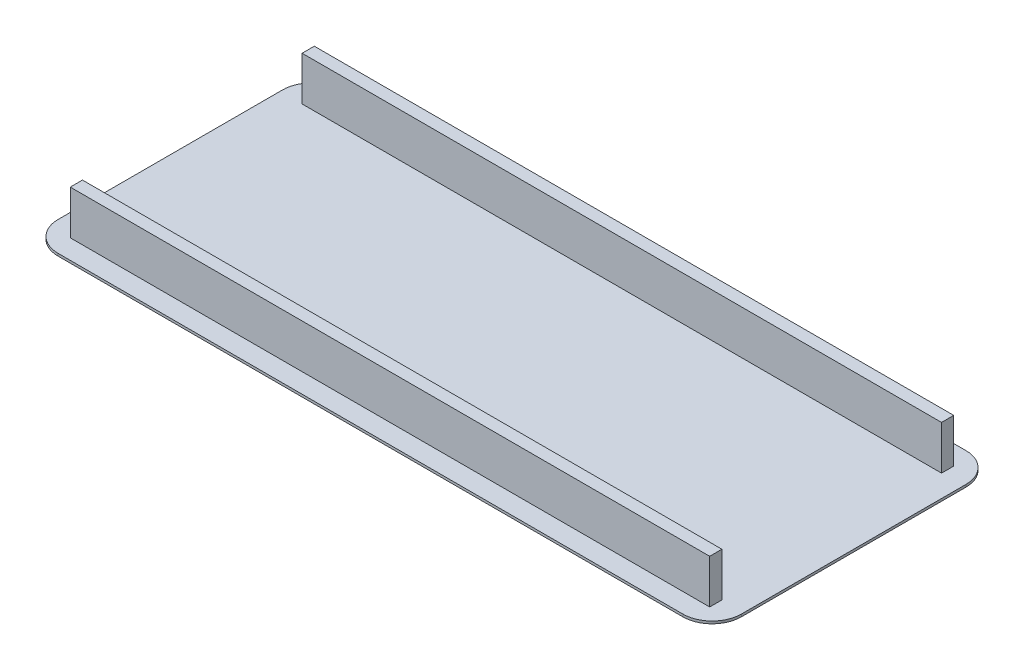
from build123d import *

# Parameters (mm, degrees)
EXTRUDE_1_DEPTH     = 0.5
SKETCH_2_W          = 131
SKETCH_2_H          = 2.5
EXTRUDE_2_DEPTH     = 9
CUT_EXTRUDE_2_DEPTH = 0.3


with BuildPart() as part:
    # 草图1 → 凸台-拉伸1 (new body)
    with BuildSketch(Plane(origin=(0, 0, 0), x_dir=(1, 0, 0), z_dir=(0, 1, 0))):
        with BuildLine():
            Line((-64, 29), (64, 29))
            ThreePointArc((64, 29), (68.242640687, 27.242640687), (70, 23))
            Line((70, 23), (70, -23))
            ThreePointArc((70, -23), (68.242640687, -27.242640687), (64, -29))
            Line((64, -29), (-64, -29))
            ThreePointArc((-64, -29), (-68.242640687, -27.242640687), (-70, -23))
            Line((-70, -23), (-70, 23))
            ThreePointArc((-70, 23), (-68.242640687, 27.242640687), (-64, 29))
        make_face()
    extrude(amount=EXTRUDE_1_DEPTH)

    # 草图2 → 凸台-拉伸2 (add)
    with BuildSketch(Plane(origin=(0, 0.5, 0), x_dir=(1, 0, 0), z_dir=(0, 1, 0))):
        with Locations((0, -23.75)):
            Rectangle(SKETCH_2_W, SKETCH_2_H)
        with Locations((0, 23.75)):
            Rectangle(SKETCH_2_W, SKETCH_2_H)
    extrude(amount=EXTRUDE_2_DEPTH)

    # 草图3 → 切除-拉伸2 (cut)
    # profile 1 of 10: a face of its own
    with BuildSketch(Plane.XZ):
        with BuildLine():
            Line((-28.258460605, -23.669099), (-27.10025748, -24.264802125))
            add(Edge.make_bspline(
                [(-27.10025748, -24.264802125), (-27.094669901, -24.271402876), (-27.083946528, -24.284070673), (-27.082209293, -24.300536069), (-27.081377271, -24.308421917)],
                knots=[0, 0, 0, 0, 1.042130724, 2, 2, 2, 2], degree=3))
            add(Edge.make_bspline(
                [(-27.081377271, -24.308421917), (-27.082518372, -24.313824587), (-27.08528481, -24.326922601), (-27.094716295, -24.336593965), (-27.10025748, -24.342276084)],
                knots=[0, 0, 0, 0, 0.824960158, 2, 2, 2, 2], degree=3))
            add(Edge.make_bspline(
                [(-27.10025748, -24.342276084), (-27.106802744, -24.351661599), (-27.12136677, -24.372545539), (-27.161543659, -24.390185162), (-27.212067351, -24.404850138), (-27.251122564, -24.408152724), (-27.272783521, -24.409984417)],
                knots=[0, 0, 0, 0, 0.702671598, 1.563531693, 2.648676305, 4, 4, 4, 4], degree=3))
            add(Edge.make_bspline(
                [(-27.272783521, -24.409984417), (-27.289312677, -24.408287525), (-27.320582353, -24.405077364), (-27.364356459, -24.396627555), (-27.402393947, -24.385915881), (-27.424993355, -24.376137853), (-27.435543938, -24.371572959)],
                knots=[0, 0, 0, 0, 1.18586077, 2.243398407, 3.179926752, 4, 4, 4, 4], degree=3))
            Line((-27.435543938, -24.371572959), (-28.470049146, -23.848135459))
            Line((-28.470049146, -23.848135459), (-30.52994498, -23.848135459))
            Line((-30.52994498, -23.848135459), (-31.430335605, -24.29800525))
            Line((-31.430335605, -24.29800525), (-27.110023105, -26.448395875))
            add(Edge.make_bspline(
                [(-27.110023105, -26.448395875), (-27.101671547, -26.453469706), (-27.085571311, -26.4632511), (-27.082739944, -26.481790831), (-27.081377271, -26.490713584)],
                knots=[0, 0, 0, 0, 1.037445277, 2, 2, 2, 2], degree=3))
            add(Edge.make_bspline(
                [(-27.081377271, -26.490713584), (-27.081377271, -26.493968792), (-27.081377271, -26.500262195), (-27.081377271, -26.506555598), (-27.081377271, -26.509593792)],
                knots=[0, 0, 0, 0, 1.034482759, 2, 2, 2, 2], degree=3))
            add(Edge.make_bspline(
                [(-27.081377271, -26.509593792), (-27.083952289, -26.5135832), (-27.088379578, -26.520442282), (-27.08344273, -26.526563903), (-27.081377271, -26.529125042)],
                knots=[0, 0, 0, 0, 1.163248231, 2, 2, 2, 2], degree=3))
            Line((-27.081377271, -26.529125042), (-27.129554355, -26.557119834))
            Line((-27.129554355, -26.557119834), (-28.289710605, -27.135244834))
            Line((-28.289710605, -27.135244834), (-28.38541373, -27.139802125))
            Line((-28.38541373, -27.139802125), (-30.677731438, -27.139802125))
            Line((-30.677731438, -27.139802125), (-30.735023105, -27.120921917))
            Line((-30.735023105, -27.120921917), (-31.895830396, -26.549307334))
            add(Edge.make_bspline(
                [(-31.895830396, -26.549307334), (-31.901383703, -26.541141003), (-31.910999517, -26.527000611), (-31.913608399, -26.510186876), (-31.914710605, -26.503083375)],
                knots=[0, 0, 0, 0, 1.155036015, 2, 2, 2, 2], degree=3))
            add(Edge.make_bspline(
                [(-31.914710605, -26.503083375), (-31.914585793, -26.496104219), (-31.914373314, -26.484222997), (-31.907698809, -26.474530368), (-31.90494498, -26.470531292)],
                knots=[0, 0, 0, 0, 1.174821255, 2, 2, 2, 2], degree=3))
            add(Edge.make_bspline(
                [(-31.90494498, -26.470531292), (-31.895613133, -26.461442343), (-31.875696651, -26.442044267), (-31.833622645, -26.424377511), (-31.782980873, -26.410243322), (-31.745136872, -26.407120994), (-31.724606438, -26.405427125)],
                knots=[0, 0, 0, 0, 0.789910378, 1.685865166, 2.744577982, 4, 4, 4, 4], degree=3))
            add(Edge.make_bspline(
                [(-31.724606438, -26.405427125), (-31.709373787, -26.405642744), (-31.679808573, -26.406061239), (-31.637578039, -26.413811425), (-31.598184559, -26.424172093), (-31.574704315, -26.43604299), (-31.563148105, -26.441885459)],
                knots=[0, 0, 0, 0, 1.090939622, 2.117416239, 3.073453622, 4, 4, 4, 4], degree=3))
            Line((-31.563148105, -26.441885459), (-30.537106438, -26.931468792))
            Line((-30.537106438, -26.931468792), (-28.49478873, -26.931468792))
            Line((-28.49478873, -26.931468792), (-27.602210605, -26.481599))
            Line((-27.602210605, -26.481599), (-31.895830396, -24.335765667))
            add(Edge.make_bspline(
                [(-31.895830396, -24.335765667), (-31.901402449, -24.329814433), (-31.913643418, -24.316740457), (-31.914334242, -24.298712405), (-31.914710605, -24.288890667)],
                knots=[0, 0, 0, 0, 0.910393925, 2, 2, 2, 2], degree=3))
            add(Edge.make_bspline(
                [(-31.914710605, -24.288890667), (-31.91424919, -24.282910645), (-31.913341472, -24.271146452), (-31.907712573, -24.260783001), (-31.90494498, -24.255687542)],
                knots=[0, 0, 0, 0, 1.016648164, 2, 2, 2, 2], degree=3))
            Line((-31.90494498, -24.255687542), (-31.866533521, -24.222484417))
            Line((-31.866533521, -24.222484417), (-30.699215813, -23.64956775))
            Line((-30.699215813, -23.64956775), (-30.641924146, -23.639802125))
            Line((-30.641924146, -23.639802125), (-28.325517896, -23.644359417))
            Line((-28.325517896, -23.644359417), (-28.258460605, -23.669099))
        make_face()
    # profile 2 of 10: a face of its own
    with BuildSketch(Plane.XZ):
        with BuildLine():
            Line((-23.865231438, -24.758291709), (-22.911455396, -25.264802125))
            Line((-22.911455396, -25.264802125), (-21.900387688, -24.723135459))
            add(Edge.make_bspline(
                [(-21.900387688, -24.723135459), (-21.893877271, -24.723135459), (-21.874780049, -24.723135459), (-21.855682827, -24.723135459), (-21.843096021, -24.723135459)],
                knots=[0, 0, 0, 0, 0.681818182, 2, 2, 2, 2], degree=3))
            add(Edge.make_bspline(
                [(-21.843096021, -24.723135459), (-21.826385952, -24.723135459), (-21.791446716, -24.723135459), (-21.75650748, -24.723135459), (-21.738278313, -24.723135459)],
                knots=[0, 0, 0, 0, 0.956521739, 2, 2, 2, 2], degree=3))
            Line((-21.738278313, -24.723135459), (-21.671221021, -24.742015667))
            Line((-21.671221021, -24.742015667), (-20.516924146, -25.331859417))
            Line((-20.516924146, -25.331859417), (-20.498043938, -25.375479209))
            Line((-20.498043938, -25.375479209), (-20.498043938, -27.062979209))
            add(Edge.make_bspline(
                [(-20.498043938, -27.062979209), (-20.500992789, -27.069248169), (-20.506964097, -27.081942568), (-20.522163689, -27.098055971), (-20.542003583, -27.110772399), (-20.566217721, -27.121360598), (-20.594742811, -27.12933022), (-20.627735145, -27.136281253), (-20.665540664, -27.138875669), (-20.692272305, -27.139482127), (-20.706377271, -27.139802125)],
                knots=[0, 0, 0, 0, 0.706099905, 1.429824784, 2.231303965, 3.107026304, 4.126900538, 5.260363266, 6.554429049, 8, 8, 8, 8], degree=3))
            add(Edge.make_bspline(
                [(-20.706377271, -27.139802125), (-20.733829811, -27.138867727), (-20.784422978, -27.137145694), (-20.843510676, -27.122695132), (-20.881413012, -27.104710424), (-20.900589281, -27.085549394), (-20.912598146, -27.06222666), (-20.913992036, -27.04511024), (-20.914710605, -27.0362865)],
                knots=[0, 0, 0, 0, 1.913775427, 3.526958208, 4.211400526, 4.811313675, 5.387216587, 6, 6, 6, 6], degree=3))
            Line((-20.914710605, -27.0362865), (-20.914710605, -25.447093792))
            Line((-20.914710605, -25.447093792), (-21.810543938, -24.999177125))
            Line((-21.810543938, -24.999177125), (-22.706377271, -25.445791709))
            Line((-22.706377271, -25.445791709), (-22.706377271, -25.97769275))
            add(Edge.make_bspline(
                [(-22.706377271, -25.97769275), (-22.709341335, -25.984165909), (-22.715269462, -25.997112228), (-22.729829253, -26.013785055), (-22.748123136, -26.028424219), (-22.771782078, -26.03905645), (-22.798918193, -26.048428722), (-22.830797912, -26.053674678), (-22.866422256, -26.057841108), (-22.891690996, -26.058222086), (-22.90494498, -26.058421917)],
                knots=[0, 0, 0, 0, 0.747803607, 1.495607214, 2.311190995, 3.20238425, 4.216381994, 5.334926181, 6.602112917, 8, 8, 8, 8], degree=3))
            add(Edge.make_bspline(
                [(-22.90494498, -26.058421917), (-22.92851171, -26.057047027), (-22.977481744, -26.054190101), (-23.036327382, -26.037818834), (-23.080882172, -26.020026543), (-23.104586446, -25.998769276), (-23.120892369, -25.973525531), (-23.122318571, -25.95427862), (-23.123043938, -25.944489625)],
                knots=[0, 0, 0, 0, 1.569004604, 3.260282924, 4.056435577, 4.732786035, 5.355493999, 6, 6, 6, 6], degree=3))
            Line((-23.123043938, -25.944489625), (-23.123043938, -25.450349))
            Line((-23.123043938, -25.450349), (-24.01431998, -24.999177125))
            Line((-24.01431998, -24.999177125), (-24.914710605, -25.4425365))
            Line((-24.914710605, -25.4425365), (-24.914710605, -27.064281292))
            add(Edge.make_bspline(
                [(-24.914710605, -27.064281292), (-24.917750379, -27.0707065), (-24.924750171, -27.085502043), (-24.94924452, -27.101820867), (-24.982374813, -27.117883827), (-25.009142082, -27.126100417), (-25.024085605, -27.130687542)],
                knots=[0, 0, 0, 0, 0.63594003, 1.46440061, 2.584435819, 4, 4, 4, 4], degree=3))
            add(Edge.make_bspline(
                [(-25.024085605, -27.130687542), (-25.029703687, -27.132125468), (-25.042529723, -27.13540824), (-25.064863263, -27.13736788), (-25.09218301, -27.139605151), (-25.112184953, -27.139732816), (-25.123043938, -27.139802125)],
                knots=[0, 0, 0, 0, 0.697444628, 1.592260218, 2.692846523, 4, 4, 4, 4], degree=3))
            add(Edge.make_bspline(
                [(-25.123043938, -27.139802125), (-25.138673768, -27.139560638), (-25.168036286, -27.139106974), (-25.209497672, -27.135581705), (-25.245163925, -27.128228003), (-25.275693329, -27.119656021), (-25.301329754, -27.107130328), (-25.318794174, -27.08700304), (-25.330096312, -27.062317856), (-25.330933975, -27.044017843), (-25.331377271, -27.034333375)],
                knots=[0, 0, 0, 0, 1.425685216, 2.678321313, 3.78852591, 4.740264277, 5.572770673, 6.343703347, 7.12347873, 8, 8, 8, 8], degree=3))
            Line((-25.331377271, -27.034333375), (-25.331377271, -24.794750042))
            add(Edge.make_bspline(
                [(-25.331377271, -24.794750042), (-25.324477397, -24.786142315), (-25.308547192, -24.766269079), (-25.268179648, -24.748079191), (-25.2157878, -24.732382769), (-25.175502298, -24.726450339), (-25.152991855, -24.723135459)],
                knots=[0, 0, 0, 0, 0.663051278, 1.530830968, 2.620295441, 4, 4, 4, 4], degree=3))
            add(Edge.make_bspline(
                [(-25.152991855, -24.723135459), (-25.124437753, -24.724527374), (-25.068851338, -24.727237023), (-25.002560966, -24.744401954), (-24.955809788, -24.767686456), (-24.931412902, -24.797111683), (-24.916550236, -24.8346854), (-24.915352363, -24.862520008), (-24.914710605, -24.877432334)],
                knots=[0, 0, 0, 0, 1.589820125, 3.09491085, 3.787941695, 4.45691949, 5.173298206, 6, 6, 6, 6], degree=3))
            Line((-24.914710605, -24.877432334), (-24.914710605, -25.160635459))
            Line((-24.914710605, -25.160635459), (-24.094398105, -24.733552125))
            add(Edge.make_bspline(
                [(-24.094398105, -24.733552125), (-24.090536372, -24.731887069), (-24.081380605, -24.727939393), (-24.064305199, -24.725377519), (-24.042804626, -24.723380149), (-24.026916877, -24.723221978), (-24.01822623, -24.723135459)],
                knots=[0, 0, 0, 0, 0.649520808, 1.539946459, 2.654343173, 4, 4, 4, 4], degree=3))
            add(Edge.make_bspline(
                [(-24.01822623, -24.723135459), (-24.003003608, -24.723402426), (-23.974136367, -24.723908687), (-23.933251055, -24.730573082), (-23.896743636, -24.741139804), (-23.875486964, -24.752709686), (-23.865231438, -24.758291709)],
                knots=[0, 0, 0, 0, 1.148130814, 2.177244396, 3.120590606, 4, 4, 4, 4], degree=3))
        make_face()
    # profile 3 of 10: a face of its own
    with BuildSketch(Plane.XZ):
        with BuildLine():
            Line((-16.222002271, -24.742015667), (-15.058590813, -25.331208375))
            Line((-15.058590813, -25.331208375), (-15.039710605, -25.359854209))
            Line((-15.039710605, -25.359854209), (-15.039710605, -26.441234417))
            Line((-15.039710605, -26.441234417), (-13.97916373, -26.991364625))
            add(Edge.make_bspline(
                [(-13.97916373, -26.991364625), (-13.974950258, -26.997825642), (-13.967601983, -27.009093624), (-13.959097223, -27.024367571), (-13.953269188, -27.035292975), (-13.951744689, -27.041684964), (-13.951168938, -27.044099)],
                knots=[0, 0, 0, 0, 1.541921242, 2.689103335, 3.504918926, 4, 4, 4, 4], degree=3))
            add(Edge.make_bspline(
                [(-13.951168938, -27.044099), (-13.951532264, -27.04970387), (-13.952210647, -27.060169005), (-13.958167878, -27.068756562), (-13.960934563, -27.072744834)],
                knots=[0, 0, 0, 0, 1.071150904, 2, 2, 2, 2], degree=3))
            add(Edge.make_bspline(
                [(-13.960934563, -27.072744834), (-13.967953475, -27.081155662), (-13.982101624, -27.098109521), (-14.010962484, -27.1172752), (-14.045239329, -27.131622797), (-14.070616727, -27.136980535), (-14.083981438, -27.139802125)],
                knots=[0, 0, 0, 0, 0.911271695, 1.836866808, 2.860811139, 4, 4, 4, 4], degree=3))
            add(Edge.make_bspline(
                [(-14.083981438, -27.139802125), (-14.105472342, -27.139750184), (-14.144340954, -27.139656243), (-14.195960788, -27.137376416), (-14.234766879, -27.135751023), (-14.255873006, -27.132134804), (-14.26431998, -27.130687542)],
                knots=[0, 0, 0, 0, 1.426300287, 2.579617453, 3.431542597, 4, 4, 4, 4], degree=3))
            Line((-14.26431998, -27.130687542), (-15.25260123, -26.652822959))
            Line((-15.25260123, -26.652822959), (-16.259111646, -27.135244834))
            Line((-16.259111646, -27.135244834), (-16.326168938, -27.139802125))
            Line((-16.326168938, -27.139802125), (-17.522783521, -27.139802125))
            Line((-17.522783521, -27.139802125), (-17.579424146, -27.120921917))
            Line((-17.579424146, -27.120921917), (-18.738278313, -26.531729209))
            Line((-18.738278313, -26.531729209), (-18.748043938, -26.484203167))
            Line((-18.748043938, -26.484203167), (-18.748043938, -25.345531292))
            Line((-18.748043938, -25.345531292), (-18.70963248, -25.311677125))
            Line((-18.70963248, -25.311677125), (-17.537106438, -24.732901084))
            Line((-17.537106438, -24.732901084), (-17.480465813, -24.723135459))
            Line((-17.480465813, -24.723135459), (-16.298174146, -24.72769275))
            Line((-16.298174146, -24.72769275), (-16.222002271, -24.742015667))
        make_face()
        Polygon((-15.456377271, -25.421703167), (-16.427080396, -24.931468792), (-17.360674146, -24.931468792), (-18.331377271, -25.417145875), (-18.331377271, -26.441234417), (-17.360674146, -26.931468792), (-16.427080396, -26.931468792), (-15.456377271, -26.436026084), align=None, mode=Mode.SUBTRACT)
    # profile 4 of 10: a face of its own
    with BuildSketch(Plane.XZ):
        with BuildLine():
            Line((-8.531247063, -24.747875042), (-7.386715813, -25.358552125))
            add(Edge.make_bspline(
                [(-7.386715813, -25.358552125), (-7.38120073, -25.366945492), (-7.372081535, -25.38082393), (-7.369038343, -25.39705795), (-7.367835605, -25.403474)],
                knots=[0, 0, 0, 0, 1.209554878, 2, 2, 2, 2], degree=3))
            add(Edge.make_bspline(
                [(-7.367835605, -25.403474), (-7.368018028, -25.410633118), (-7.368334553, -25.423054965), (-7.374843572, -25.433537923), (-7.37760123, -25.437979209)],
                knots=[0, 0, 0, 0, 1.15266562, 2, 2, 2, 2], degree=3))
            add(Edge.make_bspline(
                [(-7.37760123, -25.437979209), (-7.386703983, -25.447458818), (-7.406232708, -25.467796039), (-7.447859473, -25.487731067), (-7.498904577, -25.502103541), (-7.536767561, -25.505694449), (-7.55728873, -25.507640667)],
                knots=[0, 0, 0, 0, 0.791675291, 1.698432348, 2.752584879, 4, 4, 4, 4], degree=3))
            add(Edge.make_bspline(
                [(-7.55728873, -25.507640667), (-7.572507238, -25.507353581), (-7.601795722, -25.506801075), (-7.643975546, -25.500111421), (-7.682750232, -25.489255237), (-7.706492427, -25.478427387), (-7.718096021, -25.473135459)],
                knots=[0, 0, 0, 0, 1.099326328, 2.115687003, 3.079074017, 4, 4, 4, 4], degree=3))
            Line((-7.718096021, -25.473135459), (-8.739580396, -24.931468792))
            Line((-8.739580396, -24.931468792), (-9.676429355, -24.931468792))
            Line((-9.676429355, -24.931468792), (-11.748043938, -25.975739625))
            Line((-11.748043938, -25.975739625), (-11.748043938, -27.06363025))
            add(Edge.make_bspline(
                [(-11.748043938, -27.06363025), (-11.751083713, -27.070055458), (-11.758083505, -27.084851001), (-11.782577853, -27.101169825), (-11.815708147, -27.117232785), (-11.842475416, -27.125449376), (-11.857418938, -27.1300365)],
                knots=[0, 0, 0, 0, 0.63594003, 1.46440061, 2.584435819, 4, 4, 4, 4], degree=3))
            add(Edge.make_bspline(
                [(-11.857418938, -27.1300365), (-11.863024585, -27.13174174), (-11.875757458, -27.135615084), (-11.898216039, -27.137290353), (-11.925509913, -27.139630792), (-11.945516024, -27.139741839), (-11.956377271, -27.139802125)],
                knots=[0, 0, 0, 0, 0.702669512, 1.596069439, 2.694914535, 4, 4, 4, 4], degree=3))
            add(Edge.make_bspline(
                [(-11.956377271, -27.139802125), (-11.972007102, -27.139560638), (-12.001369619, -27.139106974), (-12.042831005, -27.135581705), (-12.078497258, -27.128228003), (-12.109026663, -27.119656021), (-12.134663088, -27.107130328), (-12.152127508, -27.08700304), (-12.163429645, -27.062317856), (-12.164267309, -27.044017843), (-12.164710605, -27.034333375)],
                knots=[0, 0, 0, 0, 1.425685216, 2.678321313, 3.78852591, 4.740264277, 5.572770673, 6.343703347, 7.12347873, 8, 8, 8, 8], degree=3))
            Line((-12.164710605, -27.034333375), (-12.164710605, -24.79019275))
            add(Edge.make_bspline(
                [(-12.164710605, -24.79019275), (-12.157877974, -24.781096714), (-12.142360604, -24.760438995), (-12.101726897, -24.742005496), (-12.049034316, -24.728498437), (-12.008815327, -24.725058849), (-11.986325188, -24.723135459)],
                knots=[0, 0, 0, 0, 0.6831576, 1.551497535, 2.630816863, 4, 4, 4, 4], degree=3))
            add(Edge.make_bspline(
                [(-11.986325188, -24.723135459), (-11.970254478, -24.723308378), (-11.939559402, -24.723638652), (-11.895339766, -24.728250433), (-11.855013202, -24.736043282), (-11.818335366, -24.746341113), (-11.786342955, -24.762552709), (-11.763002312, -24.789657249), (-11.750355501, -24.825646789), (-11.748850345, -24.852159893), (-11.748043938, -24.866364625)],
                knots=[0, 0, 0, 0, 1.210752165, 2.312538093, 3.345400688, 4.302584319, 5.181076467, 6.004233267, 6.930742675, 8, 8, 8, 8], degree=3))
            Line((-11.748043938, -24.866364625), (-11.748043938, -25.706859417))
            Line((-11.748043938, -25.706859417), (-9.789710605, -24.723135459))
            Line((-9.789710605, -24.723135459), (-8.597653313, -24.728343792))
            Line((-8.597653313, -24.728343792), (-8.531247063, -24.747875042))
        make_face()
    # profile 5 of 10: a face of its own
    with BuildSketch(Plane.XZ):
        with BuildLine():
            add(Edge.make_bspline(
                [(-3.017575188, -23.666494834), (-3.008215591, -23.671770807), (-2.989475061, -23.682334781), (-2.968953932, -23.709700474), (-2.95830936, -23.745390152), (-2.957058039, -23.771455106), (-2.956377271, -23.785635459)],
                knots=[0, 0, 0, 0, 0.89961035, 1.801271415, 2.803805809, 4, 4, 4, 4], degree=3))
            Line((-2.956377271, -23.785635459), (-2.956377271, -24.764802125))
            Line((-2.956377271, -24.764802125), (-0.915361646, -24.764802125))
            add(Edge.make_bspline(
                [(-0.915361646, -24.764802125), (-0.898392451, -24.768413615), (-0.867400412, -24.775009534), (-0.828061181, -24.794248786), (-0.797318774, -24.818338136), (-0.788677431, -24.840623331), (-0.784502271, -24.851390667)],
                knots=[0, 0, 0, 0, 1.254830507, 2.291785488, 3.174657436, 4, 4, 4, 4], degree=3))
            add(Edge.make_bspline(
                [(-0.784502271, -24.851390667), (-0.785064694, -24.85891404), (-0.786234638, -24.874564076), (-0.798848306, -24.896397357), (-0.816714497, -24.917485835), (-0.842556607, -24.938095063), (-0.880594826, -24.954464543), (-0.932439183, -24.965129902), (-0.99916962, -24.971892558), (-1.048804126, -24.972693744), (-1.076168938, -24.973135459)],
                knots=[0, 0, 0, 0, 0.517856734, 1.077239765, 1.708161716, 2.437725862, 3.348123478, 4.554397377, 6.100348401, 8, 8, 8, 8], degree=3))
            Line((-1.076168938, -24.973135459), (-2.956377271, -24.973135459))
            Line((-2.956377271, -24.973135459), (-2.956377271, -26.471182334))
            Line((-2.956377271, -26.471182334), (-2.067054355, -26.918447959))
            Line((-2.067054355, -26.918447959), (-1.074866855, -26.419750042))
            add(Edge.make_bspline(
                [(-1.074866855, -26.419750042), (-1.06086318, -26.415425353), (-1.030360551, -26.406005369), (-0.998402858, -26.405630106), (-0.981116855, -26.405427125)],
                knots=[0, 0, 0, 0, 0.918194592, 2, 2, 2, 2], degree=3))
            add(Edge.make_bspline(
                [(-0.981116855, -26.405427125), (-0.959039638, -26.406896531), (-0.914146817, -26.409884488), (-0.860908733, -26.427710819), (-0.822417344, -26.446511337), (-0.800923078, -26.464041697), (-0.786587146, -26.484695445), (-0.785190681, -26.500064326), (-0.784502271, -26.507640667)],
                knots=[0, 0, 0, 0, 1.65581985, 3.367019802, 4.176189515, 4.858562956, 5.437309886, 6, 6, 6, 6], degree=3))
            Line((-0.784502271, -26.507640667), (-0.80338248, -26.553864625))
            Line((-0.80338248, -26.553864625), (-1.97916373, -27.130687542))
            add(Edge.make_bspline(
                [(-1.97916373, -27.130687542), (-1.984781424, -27.132130688), (-1.99802491, -27.135532848), (-2.021252924, -27.137319398), (-2.050297715, -27.139645502), (-2.071602401, -27.139746518), (-2.083330396, -27.139802125)],
                knots=[0, 0, 0, 0, 0.662872796, 1.562695851, 2.658290751, 4, 4, 4, 4], degree=3))
            Line((-2.083330396, -27.139802125), (-2.159502271, -27.139802125))
            Line((-2.159502271, -27.139802125), (-2.225908521, -27.111807334))
            Line((-2.225908521, -27.111807334), (-3.363278313, -26.545401084))
            Line((-3.363278313, -26.545401084), (-3.373043938, -26.498526084))
            Line((-3.373043938, -26.498526084), (-3.373043938, -24.973135459))
            Line((-3.373043938, -24.973135459), (-5.419267896, -24.973135459))
            add(Edge.make_bspline(
                [(-5.419267896, -24.973135459), (-5.432819097, -24.972419931), (-5.458894157, -24.971043122), (-5.495492278, -24.959492155), (-5.528178209, -24.94137064), (-5.544498576, -24.923104886), (-5.552731438, -24.913890667)],
                knots=[0, 0, 0, 0, 1.073981096, 2.066541683, 3.024660611, 4, 4, 4, 4], degree=3))
            add(Edge.make_bspline(
                [(-5.552731438, -24.913890667), (-5.561048716, -24.902865509), (-5.575926181, -24.883144345), (-5.57970917, -24.858848611), (-5.581377271, -24.848135459)],
                knots=[0, 0, 0, 0, 1.118104247, 2, 2, 2, 2], degree=3))
            add(Edge.make_bspline(
                [(-5.581377271, -24.848135459), (-5.580749461, -24.84021946), (-5.57947974, -24.824209686), (-5.568797846, -24.801327229), (-5.551873954, -24.780286048), (-5.532958575, -24.763911576), (-5.512704687, -24.751858934), (-5.491176389, -24.744500282), (-5.464958974, -24.737211092), (-5.43321808, -24.732632305), (-5.396833324, -24.727587737), (-5.355038113, -24.72568696), (-5.308182243, -24.72336985), (-5.275175198, -24.723216263), (-5.257809563, -24.723135459)],
                knots=[0, 0, 0, 0, 0.744385279, 1.50548788, 2.337168717, 3.281285753, 3.850341767, 4.550293009, 5.419701265, 6.416338747, 7.572187703, 8.885514846, 10.361410074, 12, 12, 12, 12], degree=3))
            Line((-5.257809563, -24.723135459), (-3.373043938, -24.723135459))
            Line((-3.373043938, -24.723135459), (-3.373043938, -23.705557334))
            add(Edge.make_bspline(
                [(-3.373043938, -23.705557334), (-3.366432908, -23.696486965), (-3.351940952, -23.676603923), (-3.314549678, -23.658038688), (-3.266606075, -23.645536021), (-3.230359868, -23.64184599), (-3.210283521, -23.639802125)],
                knots=[0, 0, 0, 0, 0.731149018, 1.60274268, 2.672187428, 4, 4, 4, 4], degree=3))
            add(Edge.make_bspline(
                [(-3.210283521, -23.639802125), (-3.189656743, -23.640246404), (-3.151386167, -23.641070712), (-3.098454173, -23.645175741), (-3.0543062, -23.652892526), (-3.028984726, -23.662269629), (-3.017575188, -23.666494834)],
                knots=[0, 0, 0, 0, 1.264886316, 2.346848747, 3.25511085, 4, 4, 4, 4], degree=3))
        make_face()
    # profile 6 of 10: a face of its own
    with BuildSketch(Plane.XZ):
        with BuildLine():
            Line((11.213544604, -23.669099), (12.363284187, -24.264802125))
            add(Edge.make_bspline(
                [(12.363284187, -24.264802125), (12.368871765, -24.271402876), (12.379595139, -24.284070673), (12.381332373, -24.300536069), (12.382164395, -24.308421917)],
                knots=[0, 0, 0, 0, 1.042130724, 2, 2, 2, 2], degree=3))
            add(Edge.make_bspline(
                [(12.382164395, -24.308421917), (12.381944471, -24.315353692), (12.381557747, -24.327542799), (12.375158748, -24.337836337), (12.37239877, -24.342276084)],
                knots=[0, 0, 0, 0, 1.137372161, 2, 2, 2, 2], degree=3))
            add(Edge.make_bspline(
                [(12.37239877, -24.342276084), (12.363312061, -24.351597208), (12.343837673, -24.371573987), (12.301761835, -24.389730378), (12.251156674, -24.404576274), (12.213253968, -24.408083535), (12.19271127, -24.409984417)],
                knots=[0, 0, 0, 0, 0.786860381, 1.686377711, 2.746051446, 4, 4, 4, 4], degree=3))
            add(Edge.make_bspline(
                [(12.19271127, -24.409984417), (12.176396045, -24.408296733), (12.145551795, -24.405106134), (12.102251236, -24.3965145), (12.064563029, -24.386055492), (12.042231576, -24.376152693), (12.031903979, -24.371572959)],
                knots=[0, 0, 0, 0, 1.183767784, 2.237936017, 3.18510064, 4, 4, 4, 4], degree=3))
            Line((12.031903979, -24.371572959), (11.010419604, -23.848135459))
            Line((11.010419604, -23.848135459), (8.976565437, -23.848135459))
            Line((8.976565437, -23.848135459), (8.001956062, -24.339020875))
            Line((8.001956062, -24.339020875), (8.001956062, -26.445140667))
            Line((8.001956062, -26.445140667), (8.976565437, -26.931468792))
            Line((8.976565437, -26.931468792), (11.010419604, -26.931468792))
            Line((11.010419604, -26.931468792), (12.089195645, -26.419099))
            add(Edge.make_bspline(
                [(12.089195645, -26.419099), (12.103212176, -26.415042901), (12.134012482, -26.406129918), (12.166107432, -26.405675013), (12.183596687, -26.405427125)],
                knots=[0, 0, 0, 0, 0.910155323, 2, 2, 2, 2], degree=3))
            add(Edge.make_bspline(
                [(12.183596687, -26.405427125), (12.205898263, -26.406879816), (12.251231098, -26.409832728), (12.304990989, -26.427891797), (12.344129388, -26.446329623), (12.365737392, -26.464053756), (12.380080916, -26.484692731), (12.381476446, -26.500063429), (12.382164395, -26.507640667)],
                knots=[0, 0, 0, 0, 1.659243678, 3.372775974, 4.190128795, 4.867286895, 5.441610495, 6, 6, 6, 6], degree=3))
            Line((12.382164395, -26.507640667), (12.363284187, -26.553864625))
            Line((12.363284187, -26.553864625), (11.19271127, -27.130687542))
            Line((11.19271127, -27.130687542), (11.116539395, -27.139802125))
            Line((11.116539395, -27.139802125), (8.803388354, -27.139802125))
            Line((8.803388354, -27.139802125), (8.746747729, -27.120921917))
            Line((8.746747729, -27.120921917), (7.585289395, -26.536937542))
            Line((7.585289395, -26.536937542), (7.585289395, -26.4894115))
            Line((7.585289395, -26.4894115), (7.632815437, -24.2237865))
            Line((7.632815437, -24.2237865), (8.791669604, -23.64956775))
            Line((8.791669604, -23.64956775), (8.848310229, -23.639802125))
            Line((8.848310229, -23.639802125), (11.147138354, -23.644359417))
            Line((11.147138354, -23.644359417), (11.213544604, -23.669099))
        make_face()
    # profile 7 of 10: a face of its own
    with BuildSketch(Plane.XZ):
        with BuildLine():
            add(Edge.make_bspline(
                [(16.737633145, -23.665843792), (16.746408322, -23.67088984), (16.764223724, -23.681134347), (16.781951401, -23.708826453), (16.792371499, -23.743202569), (16.793183048, -23.768613251), (16.793622729, -23.78238025)],
                knots=[0, 0, 0, 0, 0.876489694, 1.779453085, 2.796952115, 4, 4, 4, 4], degree=3))
            Line((16.793622729, -23.78238025), (16.793622729, -26.450349))
            Line((16.793622729, -26.450349), (17.859377937, -26.992666709))
            add(Edge.make_bspline(
                [(17.859377937, -26.992666709), (17.867452313, -26.999182425), (17.882813705, -27.011578488), (17.885905885, -27.03098625), (17.887372729, -27.04019275)],
                knots=[0, 0, 0, 0, 1.051255849, 2, 2, 2, 2], degree=3))
            add(Edge.make_bspline(
                [(17.887372729, -27.04019275), (17.886699919, -27.046387838), (17.885296489, -27.059310328), (17.874306879, -27.077731862), (17.856724731, -27.094204419), (17.833772937, -27.11092811), (17.803185843, -27.124732228), (17.764879925, -27.132886924), (17.719383891, -27.139036646), (17.686446021, -27.13953335), (17.668622729, -27.139802125)],
                knots=[0, 0, 0, 0, 0.567464164, 1.183687821, 1.917276339, 2.775400329, 3.784257171, 4.97464692, 6.362925338, 8, 8, 8, 8], degree=3))
            Line((17.668622729, -27.139802125), (17.58333627, -27.135244834))
            Line((17.58333627, -27.135244834), (16.405601895, -26.545401084))
            Line((16.405601895, -26.545401084), (16.376956062, -26.507640667))
            Line((16.376956062, -26.507640667), (16.376956062, -23.706208375))
            add(Edge.make_bspline(
                [(16.376956062, -23.706208375), (16.383564272, -23.697128056), (16.398050048, -23.677223199), (16.435553709, -23.658833843), (16.48325918, -23.645277844), (16.519613251, -23.641751911), (16.539716479, -23.639802125)],
                knots=[0, 0, 0, 0, 0.730433381, 1.601173943, 2.673487069, 4, 4, 4, 4], degree=3))
            add(Edge.make_bspline(
                [(16.539716479, -23.639802125), (16.561664346, -23.639820669), (16.601944889, -23.639854702), (16.656818968, -23.645663441), (16.701724356, -23.651738433), (16.726674479, -23.66153911), (16.737633145, -23.665843792)],
                knots=[0, 0, 0, 0, 1.309675347, 2.403624521, 3.298835236, 4, 4, 4, 4], degree=3))
        make_face()
    # profile 8 of 10: a face of its own
    with BuildSketch(Plane.XZ):
        Polygon((24.408206062, -24.747224), (25.566409187, -25.335765667), (25.585289395, -25.378734417), (25.585289395, -26.512849), (25.546877937, -26.551260459), (24.369794604, -27.135244834), (24.274091479, -27.139802125), (21.986331062, -27.139802125), (21.929039395, -27.120921917), (20.761721687, -26.531729209), (20.751956062, -26.484203167), (20.751956062, -25.345531292), (20.79036752, -25.311677125), (21.967450854, -24.732901084), (22.02474252, -24.723135459), (24.34114877, -24.72769275), align=None)
        Polygon((25.168622729, -25.421703167), (24.190107104, -24.931468792), (22.147138354, -24.931468792), (21.168622729, -25.417145875), (21.168622729, -26.441234417), (22.147138354, -26.931468792), (24.190107104, -26.931468792), (25.168622729, -26.436026084), align=None, mode=Mode.SUBTRACT)
    # profile 9 of 10: a face of its own
    with BuildSketch(Plane.XZ):
        with BuildLine():
            add(Edge.make_bspline(
                [(32.00911752, -24.728343792), (32.022287838, -24.730914458), (32.046771466, -24.735693326), (32.078981038, -24.749212691), (32.106130309, -24.764632364), (32.117603205, -24.780198679), (32.123049812, -24.787588584)],
                knots=[0, 0, 0, 0, 1.215640592, 2.259876554, 3.173899187, 4, 4, 4, 4], degree=3))
            add(Edge.make_bspline(
                [(32.123049812, -24.787588584), (32.122673481, -24.798465202), (32.121968542, -24.81883914), (32.116855421, -24.847415284), (32.108126725, -24.871963523), (32.098810717, -24.885399601), (32.094403979, -24.89175525)],
                knots=[0, 0, 0, 0, 1.186273263, 2.222111399, 3.159007825, 4, 4, 4, 4], degree=3))
            add(Edge.make_bspline(
                [(32.094403979, -24.89175525), (32.082222843, -24.898089604), (32.056033277, -24.91170853), (32.009652562, -24.923031033), (31.955532372, -24.930139684), (31.916701222, -24.931004243), (31.89583627, -24.931468792)],
                knots=[0, 0, 0, 0, 0.802378941, 1.725123053, 2.777651539, 4, 4, 4, 4], degree=3))
            Line((31.89583627, -24.931468792), (28.726565437, -24.931468792))
            Line((28.726565437, -24.931468792), (27.751956062, -25.421052125))
            Line((27.751956062, -25.421052125), (27.751956062, -26.441885459))
            Line((27.751956062, -26.441885459), (28.726565437, -26.931468792))
            Line((28.726565437, -26.931468792), (31.971357104, -26.931468792))
            add(Edge.make_bspline(
                [(31.971357104, -26.931468792), (31.986008746, -26.932633761), (32.013368113, -26.934809136), (32.050441538, -26.946345465), (32.081998704, -26.961775305), (32.096551571, -26.97826302), (32.103518562, -26.986156292)],
                knots=[0, 0, 0, 0, 1.191958016, 2.225772044, 3.150612143, 4, 4, 4, 4], degree=3))
            add(Edge.make_bspline(
                [(32.103518562, -26.986156292), (32.111868837, -26.992864609), (32.127870642, -27.005719897), (32.130775425, -27.025958184), (32.132164395, -27.035635459)],
                knots=[0, 0, 0, 0, 1.043666639, 2, 2, 2, 2], degree=3))
            add(Edge.make_bspline(
                [(32.132164395, -27.035635459), (32.131651206, -27.041581846), (32.130599614, -27.053766758), (32.121700913, -27.071637194), (32.107634942, -27.088871549), (32.088600459, -27.107489179), (32.059716366, -27.122463196), (32.020636651, -27.133188403), (31.970660461, -27.139026169), (31.933610744, -27.139528369), (31.913414395, -27.139802125)],
                knots=[0, 0, 0, 0, 0.534169855, 1.094582808, 1.763995851, 2.539440967, 3.476578359, 4.659418556, 6.178999648, 8, 8, 8, 8], degree=3))
            Line((31.913414395, -27.139802125), (28.553388354, -27.139802125))
            Line((28.553388354, -27.139802125), (28.496747729, -27.120921917))
            Line((28.496747729, -27.120921917), (27.335289395, -26.531729209))
            Line((27.335289395, -26.531729209), (27.335289395, -26.484203167))
            Line((27.335289395, -26.484203167), (27.34505502, -25.345531292))
            Line((27.34505502, -25.345531292), (27.382815437, -25.311677125))
            Line((27.382815437, -25.311677125), (28.541669604, -24.732901084))
            Line((28.541669604, -24.732901084), (28.59896127, -24.723135459))
            Line((28.59896127, -24.723135459), (32.00911752, -24.728343792))
        make_face()
    # profile 10 of 10: a face of its own
    with BuildSketch(Plane.XZ):
        with BuildLine():
            add(Edge.make_bspline(
                [(34.27083627, -23.666494834), (34.280691012, -23.67146606), (34.300316224, -23.681366002), (34.321005656, -23.70897781), (34.333761324, -23.743547043), (34.334755102, -23.769225542), (34.335289395, -23.783031292)],
                knots=[0, 0, 0, 0, 0.922945202, 1.837997917, 2.837624398, 4, 4, 4, 4], degree=3))
            Line((34.335289395, -23.783031292), (34.335289395, -25.848135459))
            Line((34.335289395, -25.848135459), (36.236982104, -25.848135459))
            Line((36.236982104, -25.848135459), (38.422528979, -24.737458375))
            add(Edge.make_bspline(
                [(38.422528979, -24.737458375), (38.435322695, -24.735216967), (38.458275541, -24.731195718), (38.488462977, -24.726830651), (38.510356733, -24.723682541), (38.522133155, -24.723288226), (38.526695645, -24.723135459)],
                knots=[0, 0, 0, 0, 1.48099314, 2.657008124, 3.479690182, 4, 4, 4, 4], degree=3))
            add(Edge.make_bspline(
                [(38.526695645, -24.723135459), (38.537791623, -24.723251251), (38.556789167, -24.7234495), (38.575538106, -24.726446303), (38.58333627, -24.72769275)],
                knots=[0, 0, 0, 0, 1.168148728, 2, 2, 2, 2], degree=3))
            add(Edge.make_bspline(
                [(38.58333627, -24.72769275), (38.597787165, -24.730481719), (38.624687621, -24.735673406), (38.660568181, -24.74975976), (38.688984086, -24.76925468), (38.700761285, -24.786952844), (38.706383145, -24.795401084)],
                knots=[0, 0, 0, 0, 1.212977109, 2.257966587, 3.168438308, 4, 4, 4, 4], degree=3))
            add(Edge.make_bspline(
                [(38.706383145, -24.795401084), (38.706114917, -24.805616464), (38.705628151, -24.824154746), (38.702771282, -24.848870738), (38.697435903, -24.868377401), (38.690575335, -24.877779184), (38.687502937, -24.881989625)],
                knots=[0, 0, 0, 0, 1.357309335, 2.463166477, 3.311753103, 4, 4, 4, 4], degree=3))
            Line((38.687502937, -24.881989625), (36.60677377, -25.940583375))
            Line((36.60677377, -25.940583375), (38.686851895, -27.003734417))
            add(Edge.make_bspline(
                [(38.686851895, -27.003734417), (38.690978474, -27.010246428), (38.698234023, -27.02169616), (38.707632915, -27.036572101), (38.713383938, -27.047670684), (38.714918265, -27.054056926), (38.715497729, -27.056468792)],
                knots=[0, 0, 0, 0, 1.533495792, 2.696266408, 3.507624175, 4, 4, 4, 4], degree=3))
            add(Edge.make_bspline(
                [(38.715497729, -27.056468792), (38.715133082, -27.061450657), (38.714451801, -27.070758432), (38.708498827, -27.077892653), (38.705732104, -27.081208375)],
                knots=[0, 0, 0, 0, 1.070473709, 2, 2, 2, 2], degree=3))
            add(Edge.make_bspline(
                [(38.705732104, -27.081208375), (38.698875719, -27.088520736), (38.684524257, -27.103826624), (38.655777016, -27.120218981), (38.621678292, -27.132884862), (38.596683744, -27.137394115), (38.58333627, -27.139802125)],
                knots=[0, 0, 0, 0, 0.86319308, 1.806795166, 2.828794773, 4, 4, 4, 4], degree=3))
            add(Edge.make_bspline(
                [(38.58333627, -27.139802125), (38.56182984, -27.139940905), (38.523128252, -27.140190645), (38.471614906, -27.135898515), (38.432431035, -27.134010887), (38.411412811, -27.127918445), (38.402997729, -27.125479209)],
                knots=[0, 0, 0, 0, 1.420832708, 2.556839146, 3.422200576, 4, 4, 4, 4], degree=3))
            Line((38.402997729, -27.125479209), (36.236982104, -26.056468792))
            Line((36.236982104, -26.056468792), (34.335289395, -26.056468792))
            Line((34.335289395, -26.056468792), (34.335289395, -27.064932334))
            add(Edge.make_bspline(
                [(34.335289395, -27.064932334), (34.332246458, -27.07135089), (34.325239385, -27.086131117), (34.300901639, -27.102555204), (34.267419647, -27.11767191), (34.240816484, -27.126014396), (34.225914395, -27.130687542)],
                knots=[0, 0, 0, 0, 0.63730046, 1.467533319, 2.581407584, 4, 4, 4, 4], degree=3))
            add(Edge.make_bspline(
                [(34.225914395, -27.130687542), (34.220296313, -27.132125468), (34.207470277, -27.13540824), (34.185136737, -27.13736788), (34.15781699, -27.139605151), (34.137815047, -27.139732816), (34.126956062, -27.139802125)],
                knots=[0, 0, 0, 0, 0.697444628, 1.592260218, 2.692846523, 4, 4, 4, 4], degree=3))
            add(Edge.make_bspline(
                [(34.126956062, -27.139802125), (34.111326159, -27.13956067), (34.081963504, -27.139107066), (34.040503016, -27.135581406), (34.004833946, -27.128228929), (33.974313042, -27.119653249), (33.94865029, -27.107139008), (33.931406405, -27.087125712), (33.919776602, -27.062818891), (33.91902491, -27.044686092), (33.918622729, -27.034984417)],
                knots=[0, 0, 0, 0, 1.428908324, 2.68437631, 3.797090795, 4.750980799, 5.585369278, 6.358044833, 7.121497141, 8, 8, 8, 8], degree=3))
            Line((33.918622729, -27.034984417), (33.918622729, -23.706208375))
            add(Edge.make_bspline(
                [(33.918622729, -23.706208375), (33.926620801, -23.697166238), (33.943831454, -23.677708914), (33.982853568, -23.658887591), (34.031318507, -23.645571525), (34.067600706, -23.641828473), (34.08724252, -23.639802125)],
                knots=[0, 0, 0, 0, 0.770305499, 1.657581984, 2.731903264, 4, 4, 4, 4], degree=3))
            add(Edge.make_bspline(
                [(34.08724252, -23.639802125), (34.105914032, -23.640263162), (34.141145717, -23.641133102), (34.190635217, -23.645216241), (34.233555511, -23.653297536), (34.258983952, -23.662299142), (34.27083627, -23.666494834)],
                knots=[0, 0, 0, 0, 1.201295086, 2.26675014, 3.192123932, 4, 4, 4, 4], degree=3))
        make_face()
    extrude(amount=-CUT_EXTRUDE_2_DEPTH, mode=Mode.SUBTRACT)


solid = part.part
